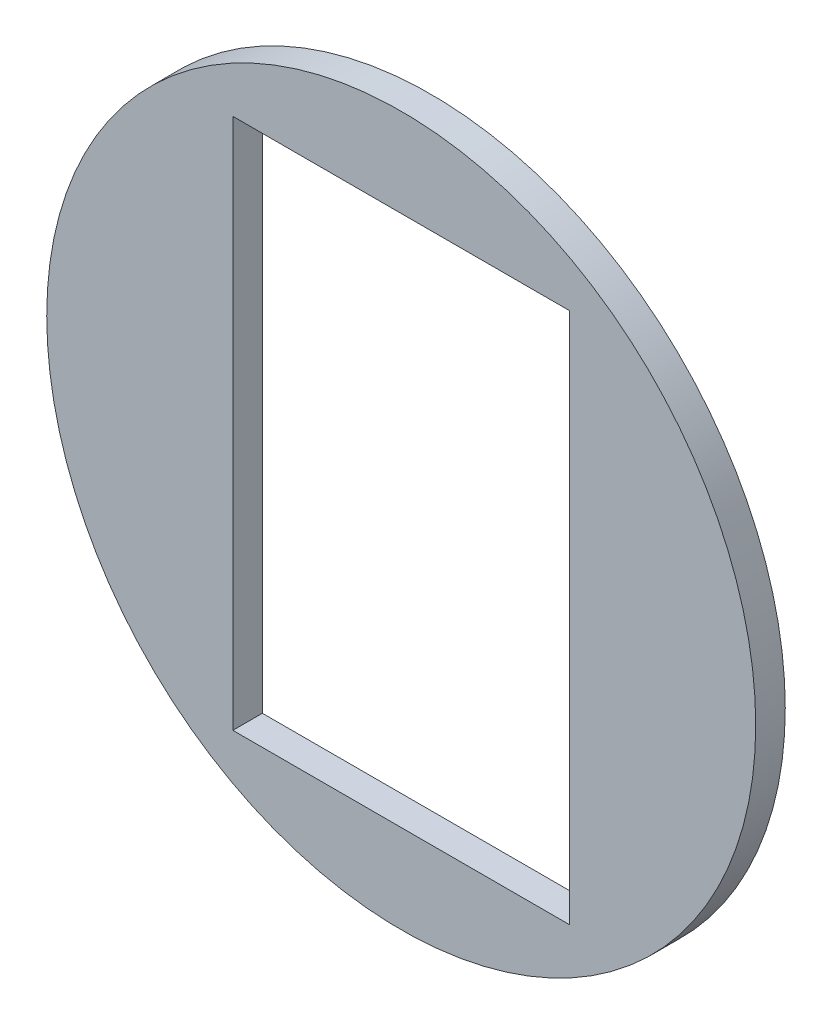
from build123d import *

# Parameters (mm, degrees)
SKETCH1_R           = 76.2
SKETCH1_W           = 72.39
SKETCH1_H           = 114.3
BOSS_EXTRUDE1_DEPTH = 6.35


with BuildPart() as part:
    # Sketch1 → Boss-Extrude1 (new body)
    with BuildSketch(Plane.XY):
        Circle(SKETCH1_R)
        Rectangle(SKETCH1_W, SKETCH1_H, mode=Mode.SUBTRACT)
    extrude(amount=BOSS_EXTRUDE1_DEPTH)


solid = part.part
